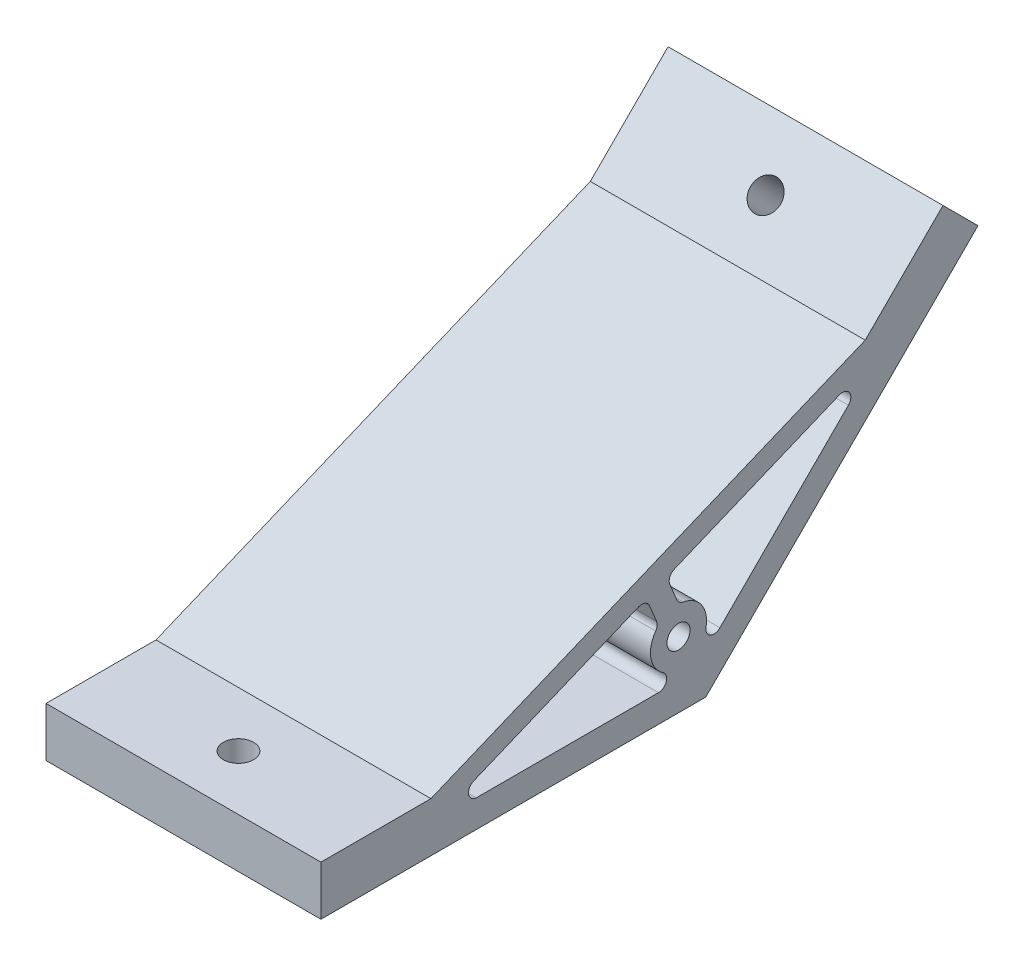
from build123d import *

# Parameters (mm, degrees)
BOSS_EXTRUDE1_DEPTH            = 25
BOSS_EXTRUDE1_DEPTH_BACK       = 25
CUT_EXTRUDE1_DEPTH             = 103.569488641
CUT_EXTRUDE2_DEPTH             = 103.569488641
F_5_5_5_5_DIAMETER_HOLE1_D     = 5.5
F_5_5_5_5_DIAMETER_HOLE1_DEPTH = 88.997474683
F_5_5_5_5_DIAMETER_HOLE2_D     = 5.5
F_5_5_5_5_DIAMETER_HOLE2_DEPTH = 55.861435714
F_4_2_4_2_DIAMETER_HOLE1_D     = 4.2
FILLET1_R                      = 1.5


with BuildPart() as part:
    # Sketch1 → Boss-Extrude1 (new, two sides: drawn at the far end of the back side and taken through both)
    with BuildSketch(Plane(origin=(7, 0, 0), x_dir=(0, 0, -1), z_dir=(1, 0, 0)).offset(-BOSS_EXTRUDE1_DEPTH_BACK)):
        Polygon((-70, 9), (-70, 0), (0, 0), (49.497474683, 49.497474683), (43.133513652, 55.861435714), (28.991378029, 41.71930009), (-49.991379635, 9), align=None)
    extrude(amount=BOSS_EXTRUDE1_DEPTH + BOSS_EXTRUDE1_DEPTH_BACK)

    # Sketch2 → Cut-Extrude1 (cut, through all)
    with BuildSketch(Plane(origin=(32, 0, 0), x_dir=(0, 0, -1), z_dir=(1, 0, 0))):
        with BuildLine():
            Line((-41.755939666, 5.002860881), (-8.618926871, 5.000000007))
            ThreePointArc((-8.618926871, 5.000000007), (-7.181014363, 6.072472193), (-7.79931621, 7.756364053))
            ThreePointArc((-7.79931621, 7.756364053), (-10.043251633, 11.471008803), (-8.614205769, 15.568771574))
            Line((-8.614205769, 15.568771574), (-10.820032984, 20.895618515))
            Line((-10.820032984, 20.895618515), (-42.237227621, 7.885876783))
            ThreePointArc((-42.237227621, 7.885876783), (-43.142866756, 6.253009411), (-41.755939666, 5.002860881))
        make_face()
    extrude(amount=-CUT_EXTRUDE1_DEPTH, mode=Mode.SUBTRACT)

    # Sketch3 → Cut-Extrude2 (cut, through all)
    with BuildSketch(Plane.ZY.offset(18)):
        with BuildLine():
            Line((-25.924897249, 32.995965061), (-2.558913388, 9.6299812))
            ThreePointArc((-2.558913388, 9.6299812), (-0.788934633, 9.368950353), (-0.028067769, 10.988222878))
            ThreePointArc((-0.028067769, 10.988222878), (1.006237273, 15.208445656), (4.918155981, 17.099730731))
            Line((4.918155981, 17.099730731), (7.125818191, 22.42949878))
            Line((7.125818191, 22.42949878), (-24.290211928, 35.442444531))
            ThreePointArc((-24.290211928, 35.442444531), (-26.111441495, 34.889980582), (-25.924897249, 32.995965061))
        make_face()
    extrude(amount=-CUT_EXTRUDE2_DEPTH, mode=Mode.SUBTRACT)

    # Ø5.5 (5.5) Diameter Hole1
    with Locations(Plane(origin=(0, 0, 0), x_dir=(-1, 0, 0), z_dir=(0, -0.7071067811865477, -0.7071067811865475))):
        with Locations((-7, 59.730322699)):
            Hole(F_5_5_5_5_DIAMETER_HOLE1_D / 2, depth=F_5_5_5_5_DIAMETER_HOLE1_DEPTH)

    # Ø5.5 (5.5) Diameter Hole2
    with Locations(Plane(origin=(0, 0, 0), x_dir=(-1, 0, 0), z_dir=(0, -1, 0))):
        with Locations((-7, -60)):
            Hole(F_5_5_5_5_DIAMETER_HOLE2_D / 2, depth=F_5_5_5_5_DIAMETER_HOLE2_DEPTH)

    # Ø4.2 (4.2) Diameter Hole1 (through all)
    with Locations(Plane.ZY.offset(18)):
        with Locations((4.970562748, 12)):
            Hole(F_4_2_4_2_DIAMETER_HOLE1_D / 2)

    # Fillet1
    fillet1_edges = [part.edges().sort_by_distance(p)[0] for p in [
        (7, 15.568771574, 8.614205769),
        (7, 22.42949878, 7.125818191),
        (7, 20.895618515, 10.820032984),
        (7, 17.099730731, 4.918155981),
    ]]
    fillet(fillet1_edges, radius=FILLET1_R)


solid = part.part
